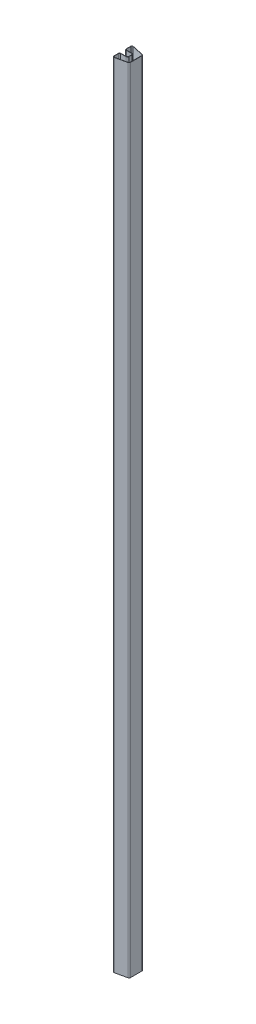
from build123d import *

# Parameters (mm, degrees)
BOSS_EXTRUDE1_DEPTH = 600
FILLET1_R           = 1
SHELL3_T            = -0.2


with BuildPart() as part:
    # Sketch1 → Boss-Extrude1 (new body)
    with BuildSketch(Plane(origin=(0, 0, 0), x_dir=(1, 0, 0), z_dir=(0, 1, 0))):
        Polygon((62.497660956, -33.372417048), (51.997660956, -31.04462309), (51.997660956, -36.54462309), (57.997660956, -36.54462309), (57.997660956, -40.54462309), (51.997660956, -40.54462309), (51.997660956, -46.04462309), (62.497660956, -43.716829132), align=None)
    extrude(amount=BOSS_EXTRUDE1_DEPTH)

    # Fillet1
    fillet1_edges = [part.edges().sort_by_distance(p)[0] for p in [
        (62.497660956, 300, 43.716829132),
        (51.997660956, 300, 46.04462309),
        (51.997660956, 300, 40.54462309),
        (57.997660956, 300, 40.54462309),
        (57.997660956, 300, 36.54462309),
        (51.997660956, 300, 36.54462309),
        (51.997660956, 300, 31.04462309),
        (62.497660956, 300, 33.372417048),
    ]]
    fillet(fillet1_edges, radius=FILLET1_R)

    # Shell3
    shell3_openings = [part.faces().sort_by_distance(p)[0] for p in [
        (57.425338322, 600, 32.431348777),
        (57.425338322, 0, 32.431348777),
    ]]
    offset(amount=SHELL3_T, openings=shell3_openings, kind=Kind.INTERSECTION)


solid = part.part
